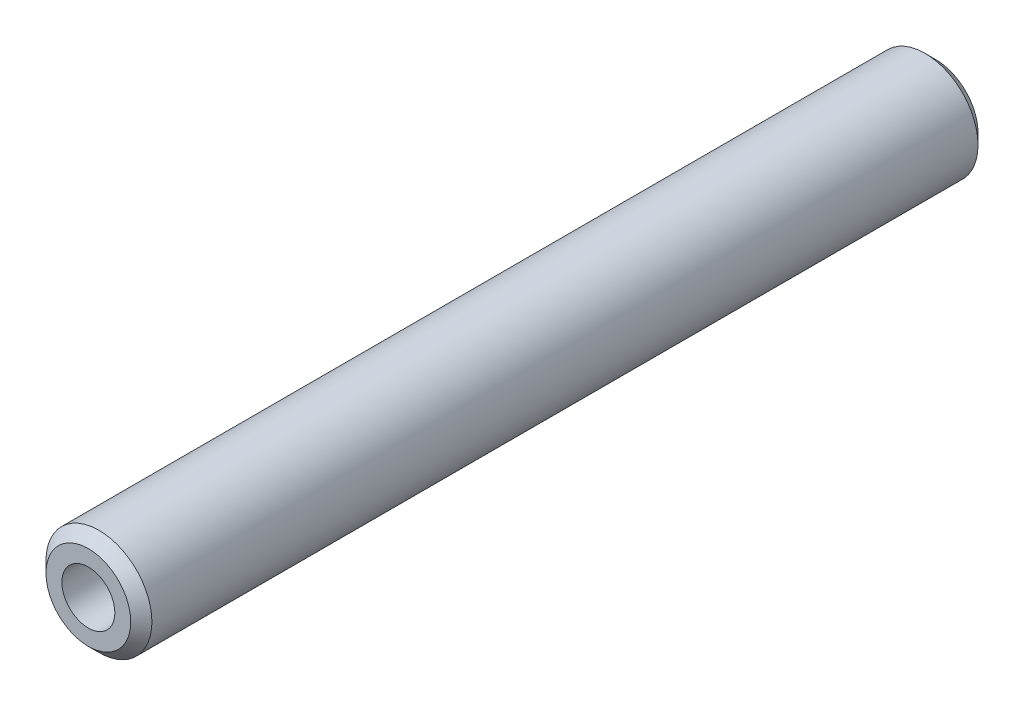
from build123d import *

# Parameters (mm, degrees)
SKETCH1_R             = 2.5
BOSS_EXTRUDE1_DEPTH   = 20
M3X0_5_TAPPED_HOLE1_D = 2.5
CHAMFER1_SIZE         = 0.5


with BuildPart() as part:
    # Sketch1 → Boss-Extrude1 (new, symmetric)
    with BuildSketch(Plane.XY):
        Circle(SKETCH1_R)
    extrude(amount=BOSS_EXTRUDE1_DEPTH, both=True)

    # M3x0.5 Tapped Hole1 (through all)
    with Locations(Plane.XY.offset(20)):
        with Locations((0, 0)):
            Hole(M3X0_5_TAPPED_HOLE1_D / 2)

    # Chamfer1
    chamfer1_edges = [part.edges().sort_by_distance(p)[0] for p in [
        (-2.5, 0, -20),
        (-2.5, 0, 20),
    ]]
    chamfer(chamfer1_edges, length=CHAMFER1_SIZE)


solid = part.part
